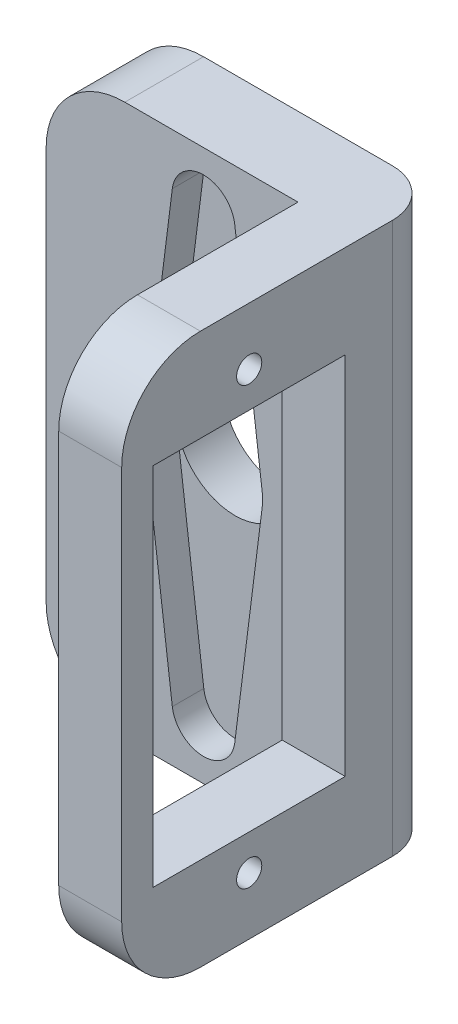
from build123d import *

# Parameters (mm, degrees)
SKETCH1_R           = 3.75
BOSS_EXTRUDE1_DEPTH = 5
CUT_EXTRUDE2_DEPTH  = 2
SKETCH5_R           = 0.8
SKETCH5_W           = 12.2
SKETCH5_H           = 23.2
BOSS_EXTRUDE2_DEPTH = 4
FILLET1_R           = 3


with BuildPart() as part:
    # Sketch1 → Boss-Extrude1 (new body)
    with BuildSketch(Plane.XY):
        with BuildLine():
            Line((10, -17.5), (-5, -17.5))
            ThreePointArc((-5, -17.5), (-8.535533906, -16.035533906), (-10, -12.5))
            Line((-10, -12.5), (-10, 12.5))
            ThreePointArc((-10, 12.5), (-8.535533906, 16.035533906), (-5, 17.5))
            Line((-5, 17.5), (10, 17.5))
            Line((10, 17.5), (10, -17.5))
        make_face()
        Circle(SKETCH1_R, mode=Mode.SUBTRACT)
    extrude(amount=-BOSS_EXTRUDE1_DEPTH)

    # Sketch3 → Cut-Extrude2 (cut)
    with BuildSketch(Plane.XY):
        with BuildLine():
            Line((-1.984313483, 14.25), (-3.720587781, 0.46875))
            ThreePointArc((-3.720587781, 0.46875), (-3.75, 0), (-3.720587781, -0.46875))
            Line((-3.720587781, -0.46875), (-1.984313483, -14.25))
            ThreePointArc((-1.984313483, -14.25), (0, -16), (1.984313483, -14.25))
            Line((1.984313483, -14.25), (3.720587781, -0.46875))
            ThreePointArc((3.720587781, -0.46875), (3.75, 0), (3.720587781, 0.46875))
            Line((3.720587781, 0.46875), (1.984313483, 14.25))
            ThreePointArc((1.984313483, 14.25), (0, 16), (-1.984313483, 14.25))
        make_face()
    extrude(amount=-CUT_EXTRUDE2_DEPTH, mode=Mode.SUBTRACT)

    # Sketch5 → Boss-Extrude2 (add)
    with BuildSketch(Plane(origin=(10, 0, 0), x_dir=(0, 0, -1), z_dir=(1, 0, 0))):
        with BuildLine():
            Line((5, 17.5), (-10.2, 17.5))
            ThreePointArc((-10.2, 17.5), (-13.735533906, 16.035533906), (-15.2, 12.5))
            Line((-15.2, 12.5), (-15.2, -12.5))
            ThreePointArc((-15.2, -12.5), (-13.735533906, -16.035533906), (-10.2, -17.5))
            Line((-10.2, -17.5), (5, -17.5))
            Line((5, -17.5), (5, 17.5))
        make_face()
        with Locations((-7.1, 13.85)):
            Circle(SKETCH5_R, mode=Mode.SUBTRACT)
        with Locations((-7.1, -13.85)):
            Circle(SKETCH5_R, mode=Mode.SUBTRACT)
        with Locations((-7.1, 0)):
            Rectangle(SKETCH5_W, SKETCH5_H, mode=Mode.SUBTRACT)
    extrude(amount=-BOSS_EXTRUDE2_DEPTH)

    # Fillet1
    fillet1_edges = [part.edges().sort_by_distance(p)[0] for p in [
        (10, 0, -5),
    ]]
    fillet(fillet1_edges, radius=FILLET1_R)


solid = part.part
